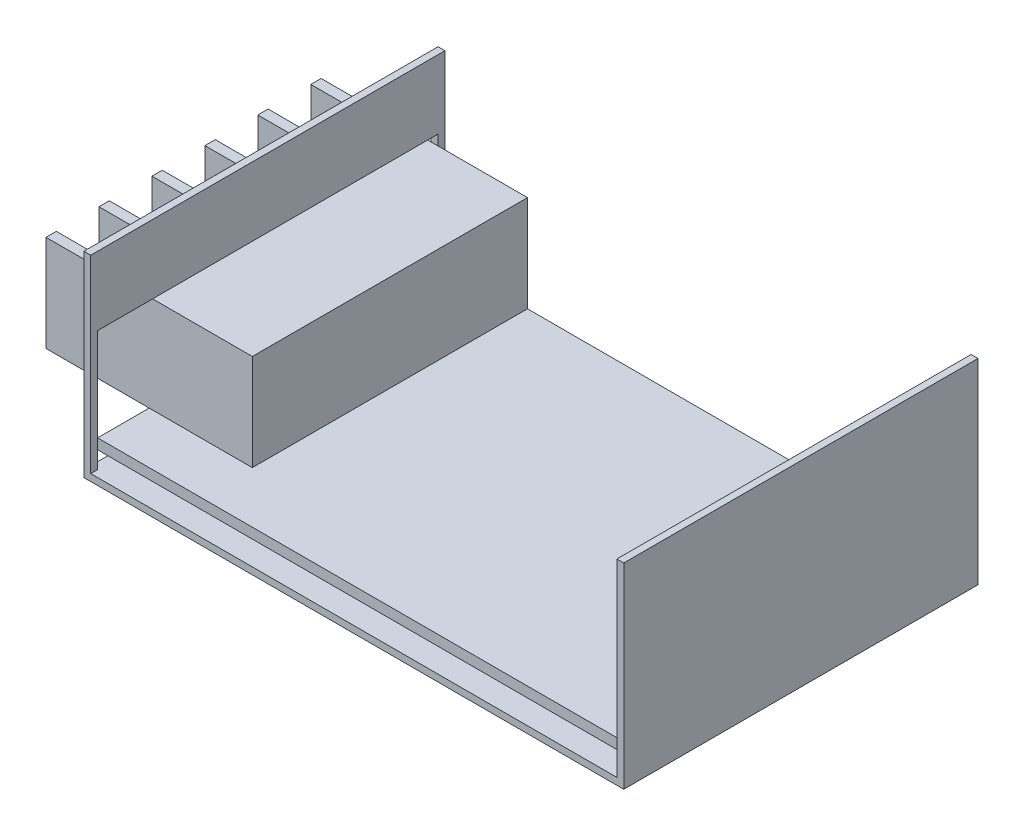
from build123d import *

# Parameters (mm, degrees)
EXTRUDE_1_DEPTH       = 51.5
SKETCH_2_W            = 49.5
SKETCH_2_H            = 17.5
CUT_EXTRUDE_1_DEPTH   = 10
SKETCH_3_W            = 47.5
SKETCH_3_H            = 1.5
EXTRUDE_2_DEPTH       = 77.5
SKETCH_4_W            = 30
SKETCH_4_H            = 40
EXTRUDE_3_DEPTH       = 14
SKETCH_5_W            = 8
SKETCH_5_H            = 6.2
CUT_EXTRUDE_2_DEPTH   = 24
CHAMFER_1_SIZE        = 2
HOLE_WIZARD_M31_D     = 2.5
HOLE_WIZARD_M31_DEPTH = 8.5
HOLE_WIZARD_M31_TIP   = 0.751075774


with BuildPart() as part:
    # Эскиз1 → Бобышка-Вытянуть1 (new body)
    with BuildSketch(Plane.XY):
        Polygon((1, 1), (77.5, 1), (77.5, 28.5), (78.5, 28.5), (78.5, 0), (0, 0), (0, 28.5), (1, 28.5), align=None)
    extrude(amount=EXTRUDE_1_DEPTH)

    # Эскиз2 → Вырез-Вытянуть1 (cut)
    with BuildSketch(Plane.ZY):
        with Locations((25.75, 9.75)):
            Rectangle(SKETCH_2_W, SKETCH_2_H)
    extrude(amount=-CUT_EXTRUDE_1_DEPTH, mode=Mode.SUBTRACT)

    # Эскиз3 → Бобышка-Вытянуть2 (add)
    with BuildSketch(Plane.ZY.offset(-77.5)):
        with Locations((25.75, 3.25)):
            Rectangle(SKETCH_3_W, SKETCH_3_H)
    extrude(amount=EXTRUDE_2_DEPTH)

    # Эскиз4 → Бобышка-Вытянуть3 (add)
    with BuildSketch(Plane(origin=(0, 4, 0), x_dir=(1, 0, 0), z_dir=(0, 1, 0))):
        with Locations((0, -22)):
            Rectangle(SKETCH_4_W, SKETCH_4_H)
    extrude(amount=EXTRUDE_3_DEPTH)

    # Эскиз5 → Вырез-Вытянуть2 (cut)
    with BuildSketch(Plane(origin=(0, 18, 0), x_dir=(1, 0, 0), z_dir=(0, 1, 0))):
        with Locations((-11, -6.6)):
            Rectangle(SKETCH_5_W, SKETCH_5_H)
        with Locations((-11, -37.4)):
            Rectangle(SKETCH_5_W, SKETCH_5_H)
        with Locations((-11, -14.3)):
            Rectangle(SKETCH_5_W, SKETCH_5_H)
        with Locations((-11, -22)):
            Rectangle(SKETCH_5_W, SKETCH_5_H)
        with Locations((-11, -29.7)):
            Rectangle(SKETCH_5_W, SKETCH_5_H)
    extrude(amount=-CUT_EXTRUDE_2_DEPTH, mode=Mode.SUBTRACT)

    # Фаска1
    chamfer_1_edges = [part.edges().sort_by_distance(p)[0] for p in [
        (-7, 4, 14.3),
        (-7, 18, 14.3),
        (-7, 4, 22),
        (-7, 18, 22),
        (-7, 4, 29.7),
        (-7, 18, 29.7),
        (-7, 4, 37.4),
        (-7, 18, 37.4),
        (-7, 4, 6.6),
        (-7, 18, 6.6),
    ]]
    chamfer(chamfer_1_edges, length=CHAMFER_1_SIZE)

    # Отверстие обработанное метчиком M31
    with Locations(Plane(origin=(0, 0, 0), x_dir=(-1, 0, 0), z_dir=(0, -1, 0))):
        with Locations((-13, -25.4), (-68, -25.4)):
            Hole(HOLE_WIZARD_M31_D / 2, depth=HOLE_WIZARD_M31_DEPTH)
            with Locations((0, 0, -(HOLE_WIZARD_M31_DEPTH + HOLE_WIZARD_M31_TIP / 2))):  # 118° drill point
                Cone(0, HOLE_WIZARD_M31_D / 2, HOLE_WIZARD_M31_TIP, mode=Mode.SUBTRACT)


solid = part.part
